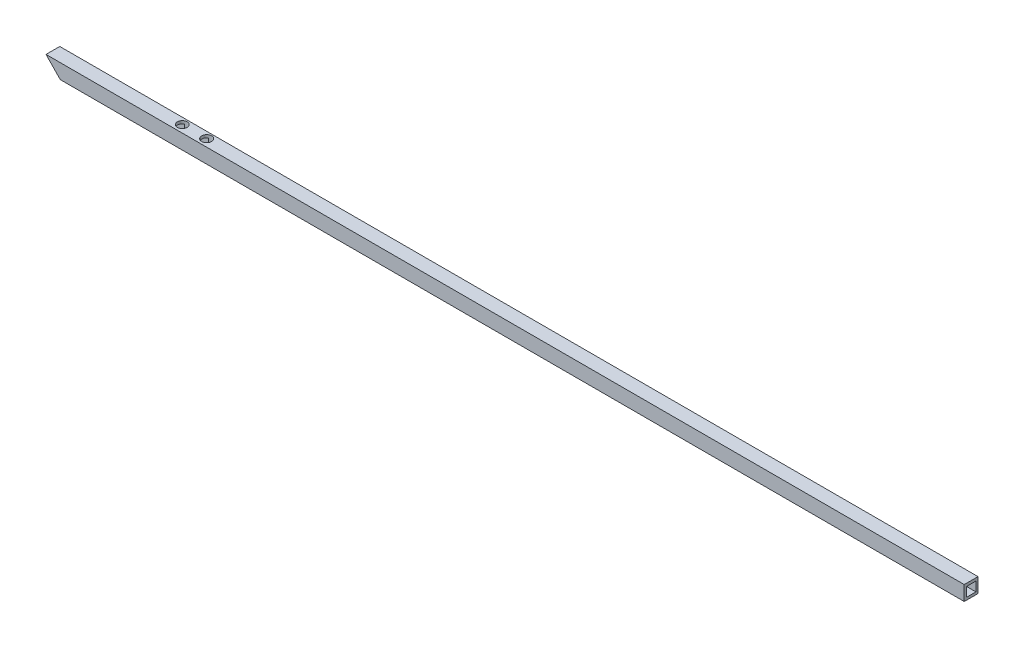
from build123d import *

# Parameters (mm, degrees)
BOSS_EXTRUDE1_DEPTH = 7.62
SKETCH3_W           = 5.16456173
SKETCH3_H           = 5.178482382
CUT_EXTRUDE2_DEPTH  = 509.122439065
SKETCH4_R           = 2.695407271
SKETCH4_R_2         = 2.747845639
CUT_EXTRUDE3_DEPTH  = 5.08
SKETCH5_R           = 2.274624141
SKETCH5_R_2         = 2.355331531
CUT_EXTRUDE4_DEPTH  = 5.08


with BuildPart() as part:
    # Sketch1 → Boss-Extrude1 (new body)
    with BuildSketch(Plane.XY):
        Polygon((-69.961161881, 0), (438.038838119, 0), (438.038838119, -8.14546996), (-62.055264567, -8.14546996), align=None)
    extrude(amount=BOSS_EXTRUDE1_DEPTH)

    # Sketch3 → Cut-Extrude2 (cut, through all)
    with BuildSketch(Plane(origin=(438.038838119, 0, 0), x_dir=(0, 0, -1), z_dir=(1, 0, 0))):
        with Locations((-3.745160102, -4.144469612)):
            Rectangle(SKETCH3_W, SKETCH3_H)
    extrude(amount=-CUT_EXTRUDE2_DEPTH, mode=Mode.SUBTRACT)

    # Sketch4 → Cut-Extrude3 (cut)
    with BuildSketch(Plane(origin=(0, 0, 0), x_dir=(1, 0, 0), z_dir=(0, 1, 0))):
        with Locations(Location((1.367483079, -3.546323854, 0), (0, 0, 270))):
            Circle(SKETCH4_R)
        with Locations(Location((14.857584748, -3.546323854, 0), (0, 0, 270))):
            Circle(SKETCH4_R_2)
    extrude(amount=-CUT_EXTRUDE3_DEPTH, mode=Mode.SUBTRACT)

    # Sketch5 → Cut-Extrude4 (cut)
    with BuildSketch(Plane.XZ.offset(8.14546996)):
        with Locations((355.642137029, 4.345547061)):
            Circle(SKETCH5_R)
        with Locations((368.018591587, 4.345547061)):
            Circle(SKETCH5_R_2)
    extrude(amount=-CUT_EXTRUDE4_DEPTH, mode=Mode.SUBTRACT)


solid = part.part
